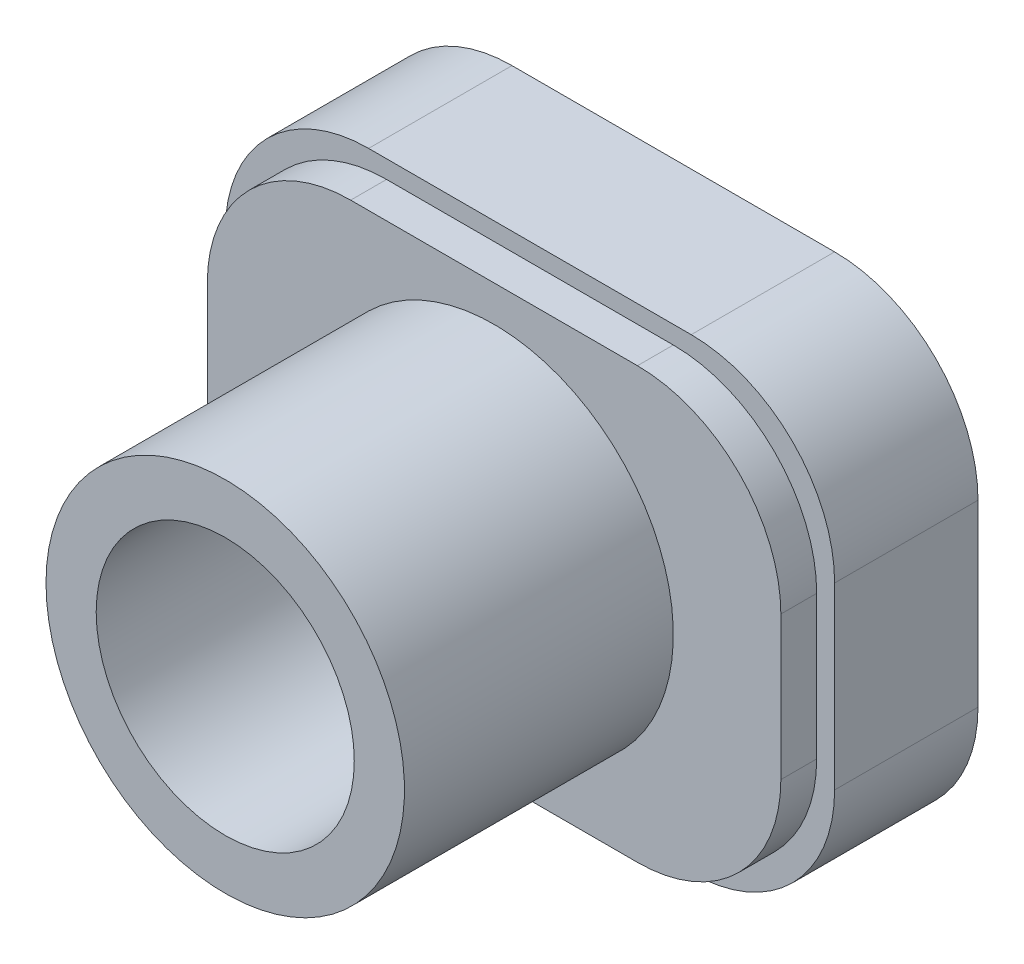
from build123d import *

# Parameters (mm, degrees)
BOSS_EXTRUDE1_DEPTH = 5.08
BOSS_EXTRUDE2_DEPTH = 1.27
SKETCH4_R           = 6.35
BOSS_EXTRUDE3_DEPTH = 9.525
SKETCH5_R           = 4.572
CUT_EXTRUDE1_DEPTH  = 12.7


with BuildPart() as part:
    # Sketch1 → Boss-Extrude1 (new body)
    with BuildSketch(Plane.XY):
        with BuildLine():
            Line((5.715, -8.255), (-5.715, -8.255))
            ThreePointArc((-5.715, -8.255), (-9.307102448, -6.767102448), (-10.795, -3.175))
            Line((-10.795, -3.175), (-10.795, 3.175))
            ThreePointArc((-10.795, 3.175), (-9.307102448, 6.767102448), (-5.715, 8.255))
            Line((-5.715, 8.255), (5.715, 8.255))
            ThreePointArc((5.715, 8.255), (9.307102448, 6.767102448), (10.795, 3.175))
            Line((10.795, 3.175), (10.795, -3.175))
            ThreePointArc((10.795, -3.175), (9.307102448, -6.767102448), (5.715, -8.255))
        make_face()
        with BuildLine():
            Line((3.67, -6), (-3.67, -6))
            ThreePointArc((-3.67, -6), (-7.262102448, -4.512102448), (-8.75, -0.92))
            Line((-8.75, -0.92), (-8.75, 0.92))
            ThreePointArc((-8.75, 0.92), (-7.262102448, 4.512102448), (-3.67, 6))
            Line((-3.67, 6), (3.67, 6))
            ThreePointArc((3.67, 6), (7.262102448, 4.512102448), (8.75, 0.92))
            Line((8.75, 0.92), (8.75, -0.92))
            ThreePointArc((8.75, -0.92), (7.262102448, -4.512102448), (3.67, -6))
        make_face(mode=Mode.SUBTRACT)
    extrude(amount=BOSS_EXTRUDE1_DEPTH)

    # Sketch2 → Boss-Extrude2 (add)
    with BuildSketch(Plane.XY.offset(5.08)):
        with BuildLine():
            Line((5.08, -7.62), (-5.08, -7.62))
            ThreePointArc((-5.08, -7.62), (-8.672102448, -6.132102448), (-10.16, -2.54))
            Line((-10.16, -2.54), (-10.16, 2.54))
            ThreePointArc((-10.16, 2.54), (-8.672102448, 6.132102448), (-5.08, 7.62))
            Line((-5.08, 7.62), (5.08, 7.62))
            ThreePointArc((5.08, 7.62), (8.672102448, 6.132102448), (10.16, 2.54))
            Line((10.16, 2.54), (10.16, -2.54))
            ThreePointArc((10.16, -2.54), (8.672102448, -6.132102448), (5.08, -7.62))
        make_face()
    extrude(amount=BOSS_EXTRUDE2_DEPTH)

    # Sketch4 → Boss-Extrude3 (add)
    with BuildSketch(Plane.XY.offset(6.35)):
        with Locations(Location((0, 0, 0), (0, 0, 180))):
            Circle(SKETCH4_R)
    extrude(amount=BOSS_EXTRUDE3_DEPTH)

    # Sketch5 → Cut-Extrude1 (cut)
    with BuildSketch(Plane.XY.offset(15.875)):
        Circle(SKETCH5_R)
    extrude(amount=-CUT_EXTRUDE1_DEPTH, mode=Mode.SUBTRACT)


solid = part.part
